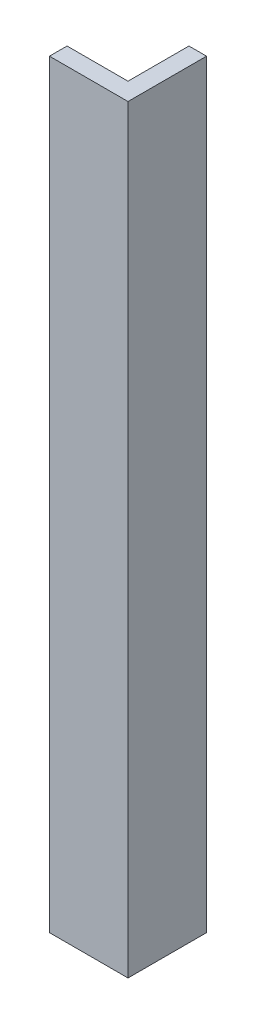
from build123d import *

# Parameters (mm, degrees)
BOSS_EXTRUDE1_DEPTH = 137


with BuildPart() as part:
    # Sketch1 → Boss-Extrude1 (new body)
    with BuildSketch(Plane(origin=(0, 0, 0), x_dir=(1, 0, 0), z_dir=(0, 1, 0))):
        Polygon((-3.175, 3.175), (-14.175, 3.175), (-14.175, 0), (0, 0), (0, 14.175), (-3.175, 14.175), align=None)
    extrude(amount=BOSS_EXTRUDE1_DEPTH)


solid = part.part
